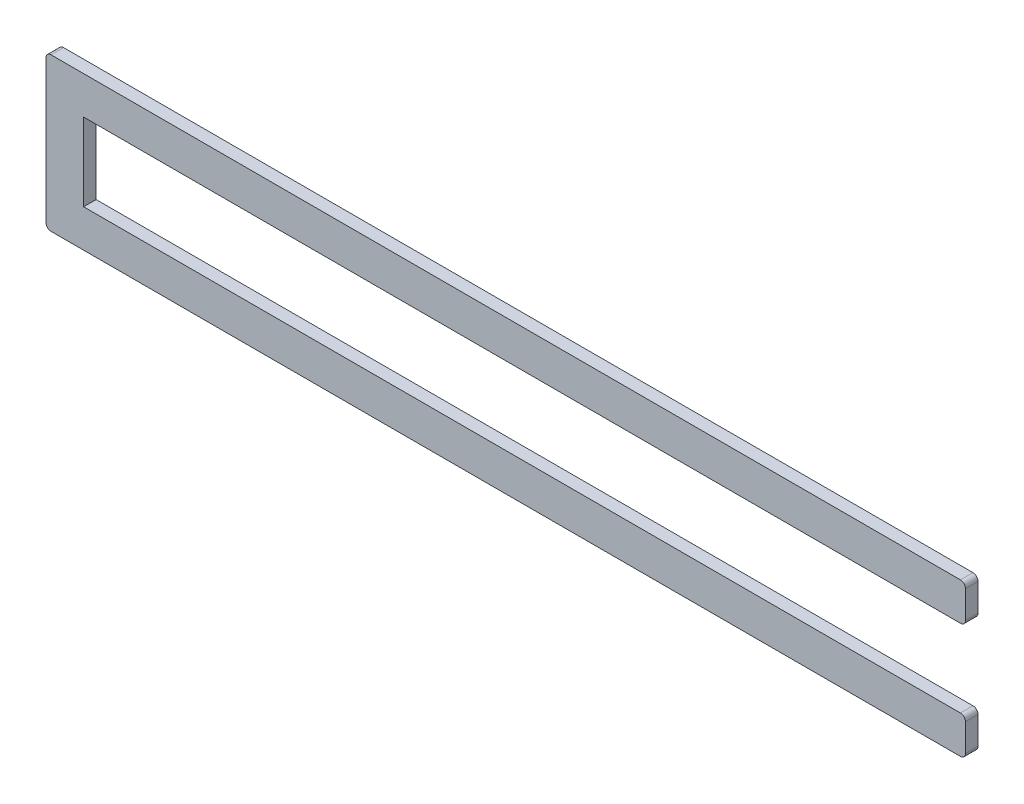
from build123d import *

# Parameters (mm, degrees)
SALIENTE_EXTRUIR1_DEPTH = 6.35
CROQUIS3_W              = 446.786
CROQUIS3_H              = 39.37
CORTAR_EXTRUIR1_DEPTH   = 246.599940908
REDONDEO2_R             = 2.54


with BuildPart() as part:
    # Croquis2 → Saliente-Extruir1 (new body)
    with BuildSketch(Plane.XY):
        Polygon((-242.443, -38.735), (-242.443, 38.735), (223.393, 38.735), (223.393, 19.685), (223.393, -19.685), (223.393, -38.735), align=None)
    extrude(amount=SALIENTE_EXTRUIR1_DEPTH)

    # Croquis3 → Cortar-Extruir1 (cut, through all)
    with BuildSketch(Plane.XY.offset(6.35)):
        Rectangle(CROQUIS3_W, CROQUIS3_H)
    extrude(amount=-CORTAR_EXTRUIR1_DEPTH, mode=Mode.SUBTRACT)

    # Redondeo2
    redondeo2_edges = [part.edges().sort_by_distance(p)[0] for p in [
        (223.393, -38.735, 3.175),
        (-242.443, -38.735, 3.175),
        (-242.443, 38.735, 3.175),
        (223.393, 38.735, 3.175),
        (223.393, 19.685, 3.175),
        (223.393, -19.685, 3.175),
    ]]
    fillet(redondeo2_edges, radius=REDONDEO2_R)


solid = part.part
